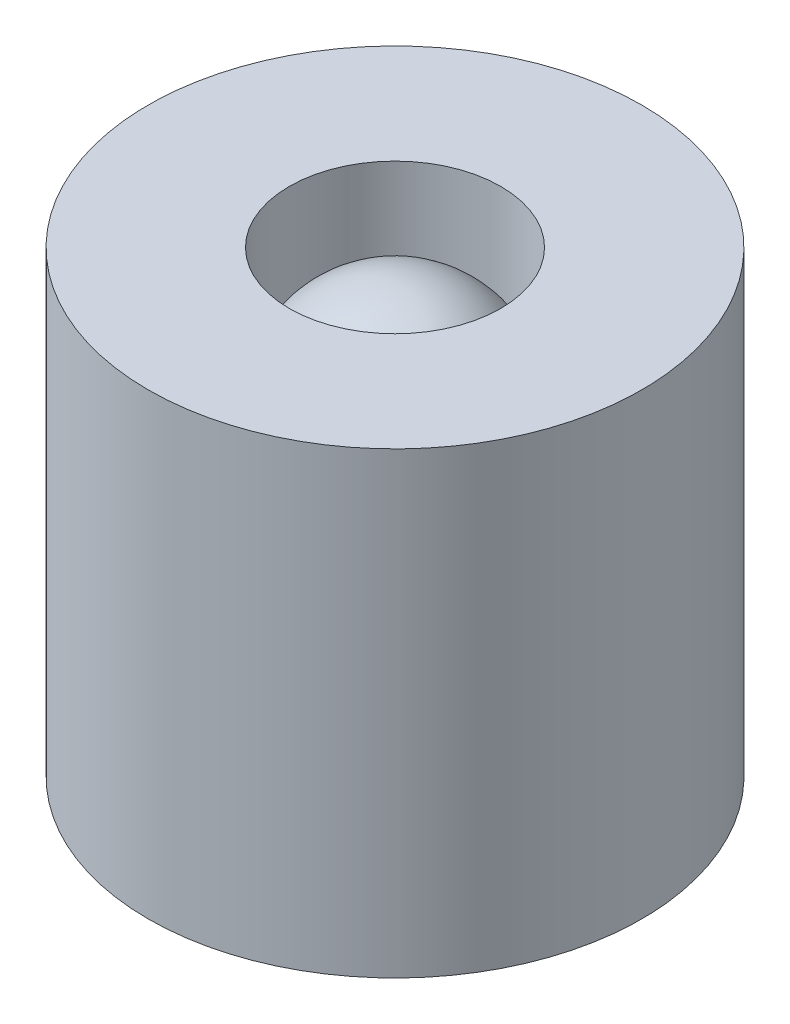
from build123d import *

# Parameters (mm, degrees)
SKETCH_1_R      = 3.5
SKETCH_1_R_2    = 1.5
EXTRUDE_1_DEPTH = 6.5


with BuildPart() as part:
    # 草图1 → 凸台-拉伸1 (new body)
    with BuildSketch(Plane(origin=(0, 0, 0), x_dir=(1, 0, 0), z_dir=(0, 1, 0))):
        with Locations(Location((0, 0, 0), (0, 0, 90))):
            Circle(SKETCH_1_R)
        with Locations(Location((0, 0, 0), (0, 0, 90))):
            Circle(SKETCH_1_R_2, mode=Mode.SUBTRACT)
    extrude(amount=EXTRUDE_1_DEPTH)

    # 草图3 → 旋转5 (revolve)
    with BuildSketch(Plane(origin=(0, 4.5, 0), x_dir=(1, 0, 0), z_dir=(0, 1, 0))):
        with BuildLine():
            Line((-1.55, 0), (1.55, 0))
            ThreePointArc((1.55, 0), (0, -1.55), (-1.55, 0))
        make_face()
    revolve(axis=Axis((-3.959014724, 4.5, 0), (1, 0, 0)))


solid = part.part
